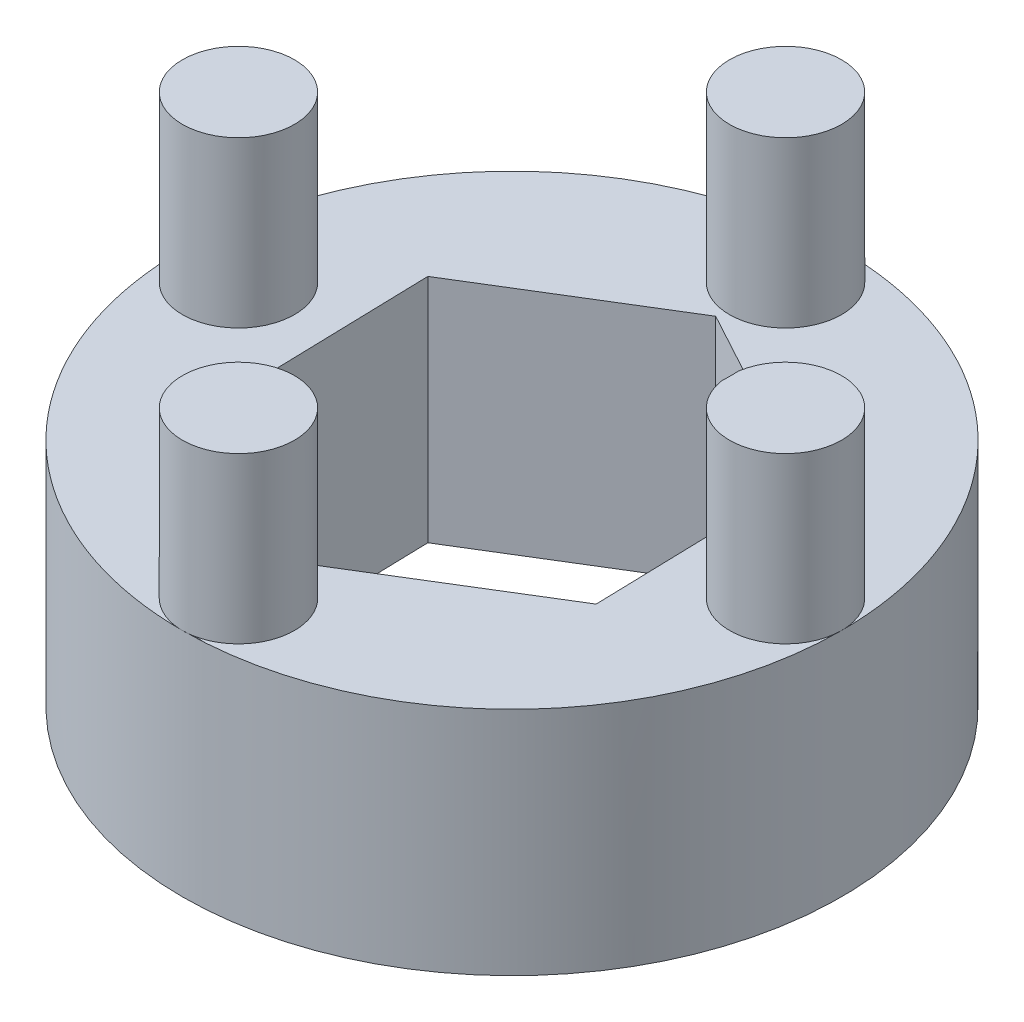
from build123d import *

# Parameters (mm, degrees)
SKETCH_1_R          = 10
EXTRUDE_1_DEPTH     = 7
SKETCH_2_R          = 1.7
EXTRUDE_2_DEPTH     = 5
CUT_EXTRUDE_1_DEPTH = 7


with BuildPart() as part:
    # 草图1 → 凸台-拉伸1 (new body)
    with BuildSketch(Plane(origin=(0, 0, 0), x_dir=(1, 0, 0), z_dir=(0, 1, 0))):
        with Locations(Location((0, 0, 0), (0, 0, 270))):
            Circle(SKETCH_1_R)
    extrude(amount=EXTRUDE_1_DEPTH)

    # 草图2 → 凸台-拉伸2 (add)
    with BuildSketch(Plane(origin=(0, 7, 0), x_dir=(1, 0, 0), z_dir=(0, 1, 0))):
        with BuildLine():
            ThreePointArc((6.618999669, 0.253451944), (6.623850429, 0), (6.618999669, -0.253451944))
            ThreePointArc((6.618999669, -0.253451944), (10, 0), (6.618999669, 0.253451944))
        make_face()
        with Locations(Location((0, 8.3, 0), (0, 0, 89.999317856))):
            Circle(SKETCH_2_R)
        with Locations(Location((0, -8.3, 0), (0, 0, 269.999317859))):
            Circle(SKETCH_2_R)
        with Locations(Location((-8.3, 0, 0), (0, 0, 179.999317857))):
            Circle(SKETCH_2_R)
    extrude(amount=EXTRUDE_2_DEPTH)

    # 草图3 → 切除-拉伸1 (cut)
    with BuildSketch(Plane(origin=(0, 7, 0), x_dir=(1, 0, 0), z_dir=(0, 1, 0))):
        Polygon((-5.581963916, 3.029028256), (-5.414197376, -3.319608426), (0.16776654, -6.348636682), (5.581963916, -3.029028256), (5.414197376, 3.319608426), (-0.16776654, 6.348636682), align=None)
    extrude(amount=-CUT_EXTRUDE_1_DEPTH, mode=Mode.SUBTRACT)


solid = part.part
